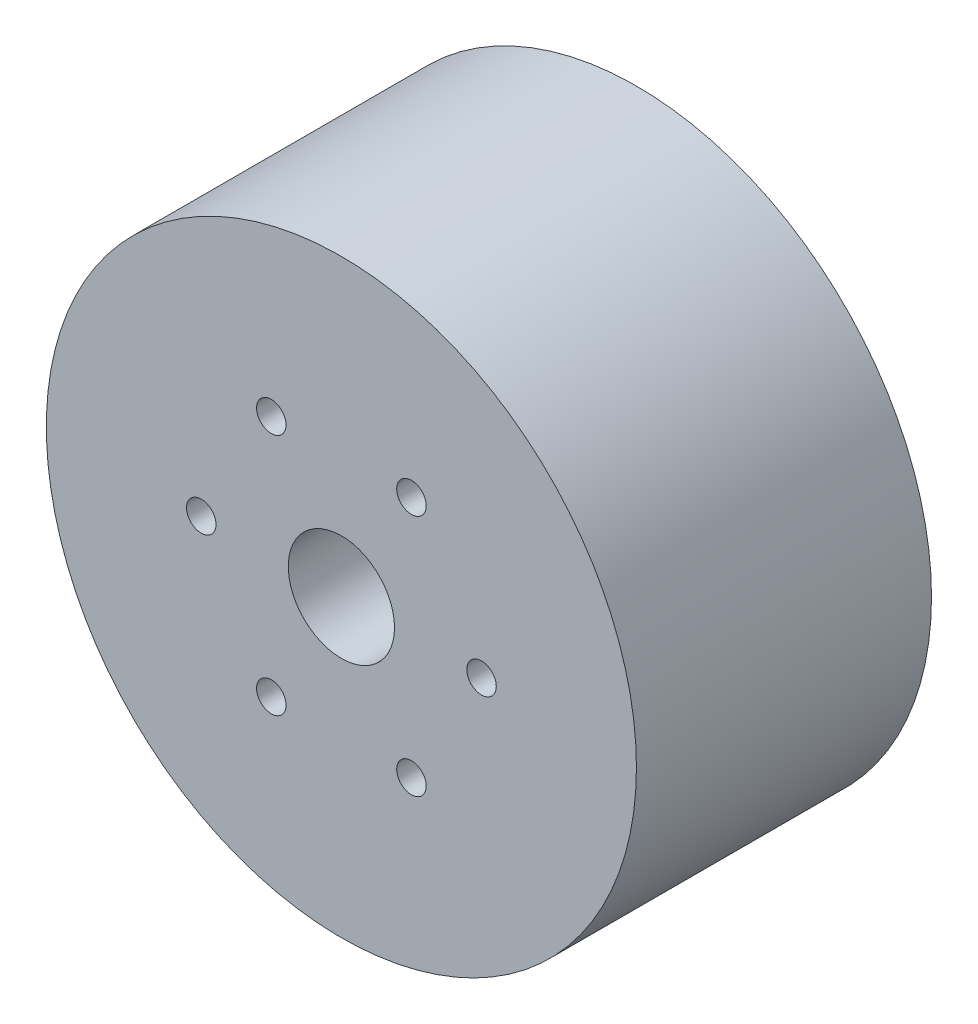
from build123d import *

# Parameters (mm, degrees)
SKETCH_1_R               = 50
SKETCH_1_R_2             = 9
EXTRUDE_1_DEPTH          = 50
SKETCH_2_R               = 2.5
CUT_EXTRUDE_1_DEPTH      = 87.602540378
PATTERN_CIRCULAR_1_COUNT = 6


with BuildPart() as part:
    # Эскиз1 → Бобышка-Вытянуть1 (new body)
    with BuildSketch(Plane.XY):
        Circle(SKETCH_1_R)
        Circle(SKETCH_1_R_2, mode=Mode.SUBTRACT)
    extrude(amount=EXTRUDE_1_DEPTH)

    # Эскиз2 → Вырез-Вытянуть1 (cut, symmetric)
    with BuildSketch(Plane.XY.offset(50)):
        with Locations((23.75, 0)):
            Circle(SKETCH_2_R)
    cut_extrude_1 = extrude(amount=CUT_EXTRUDE_1_DEPTH, both=True, mode=Mode.SUBTRACT)

    # Круговой массив1: Вырез-Вытянуть1 ×6 about axis
    pattern_circular_1_axis = Axis((0, 0, 0), (0, 0, 1))
    for i in range(1, PATTERN_CIRCULAR_1_COUNT):
        add(cut_extrude_1.rotate(pattern_circular_1_axis, i * 360 / PATTERN_CIRCULAR_1_COUNT), mode=Mode.SUBTRACT)


solid = part.part
